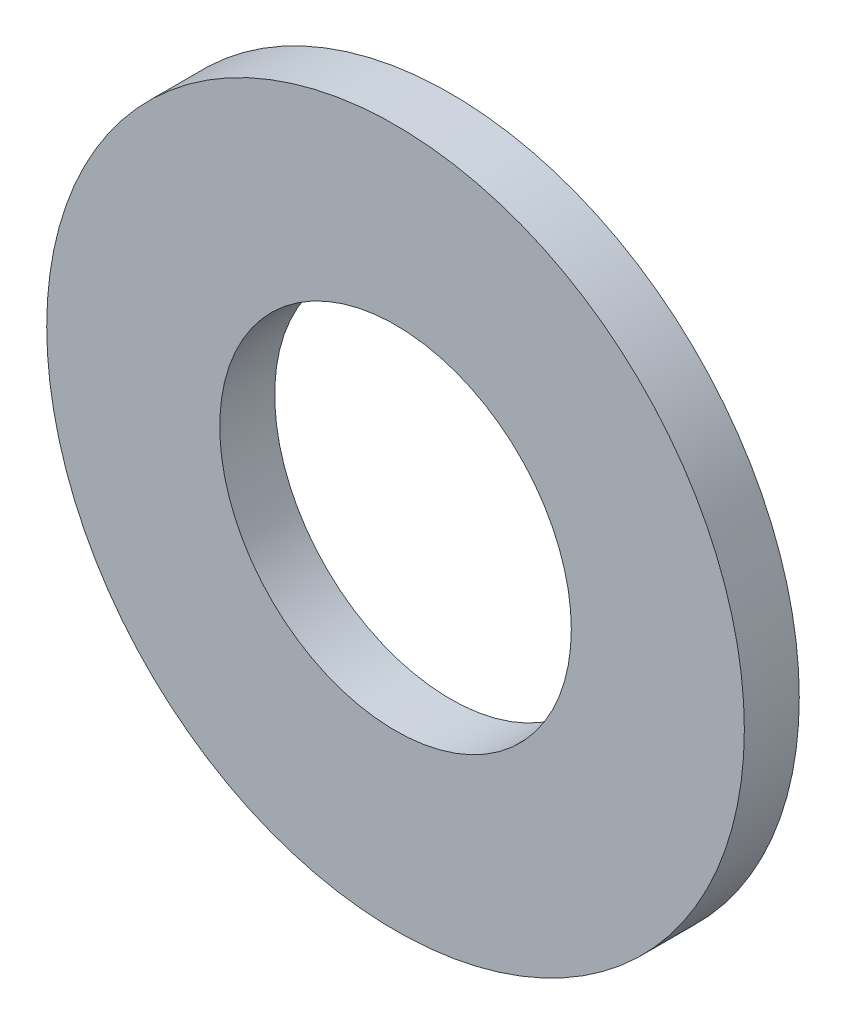
from build123d import *

# Parameters (mm, degrees)
SKETCH1_R      = 3.175
SKETCH1_R_2    = 1.6
EXTRUDE1_DEPTH = 0.5


with BuildPart() as part:
    # Sketch1 → Extrude1 (new body)
    with BuildSketch(Plane.XY):
        Circle(SKETCH1_R)
        Circle(SKETCH1_R_2, mode=Mode.SUBTRACT)
    extrude(amount=-EXTRUDE1_DEPTH)


solid = part.part
